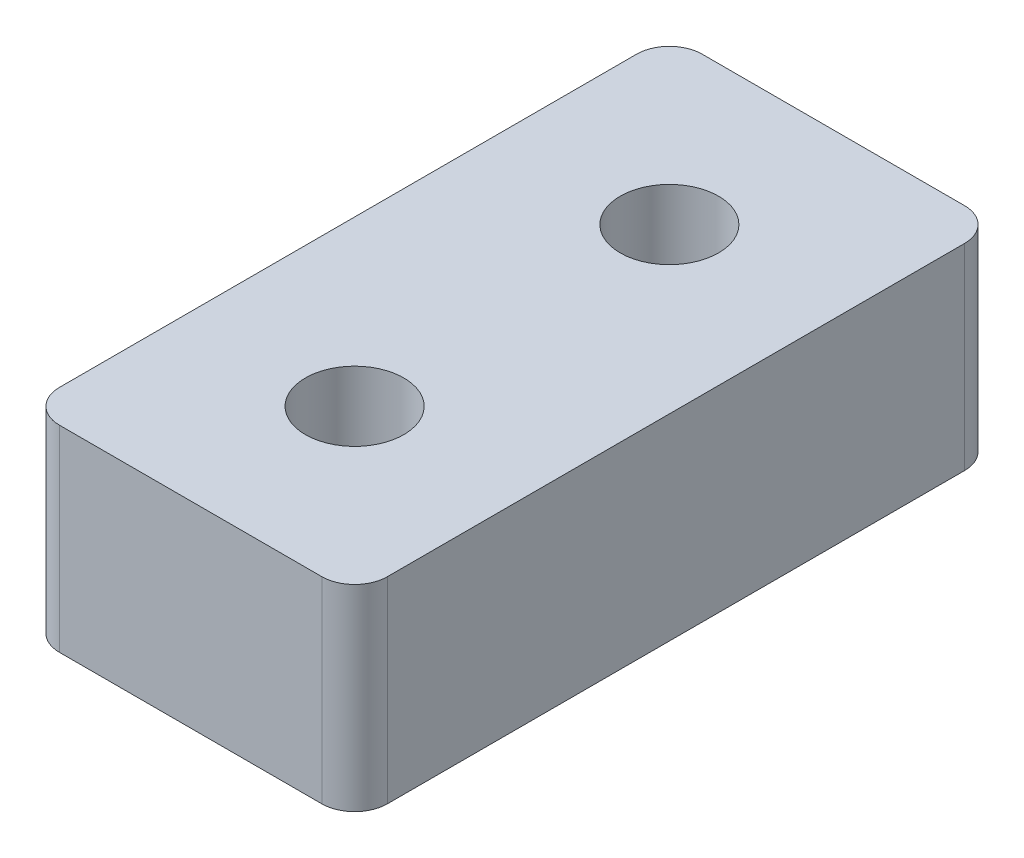
from build123d import *

# Parameters (mm, degrees)
SKETCH1_W           = 10
SKETCH1_H           = 19.6
SKETCH1_R           = 1.5
BOSS_EXTRUDE1_DEPTH = 6
FILLET1_R           = 1


with BuildPart() as part:
    # Sketch1 → Boss-Extrude1 (new body)
    with BuildSketch(Plane(origin=(0, 0, 0), x_dir=(1, 0, 0), z_dir=(0, 1, 0))):
        with Locations((5, 9.8)):
            Rectangle(SKETCH1_W, SKETCH1_H)
        with Locations(Location((5, 14.6, 0), (0, 0, 270))):
            Circle(SKETCH1_R, mode=Mode.SUBTRACT)
        with Locations(Location((5, 5, 0), (0, 0, 270))):
            Circle(SKETCH1_R, mode=Mode.SUBTRACT)
    extrude(amount=BOSS_EXTRUDE1_DEPTH)

    # Fillet1
    fillet1_edges = [part.edges().sort_by_distance(p)[0] for p in [
        (0, 3, -19.6),
        (10, 3, -19.6),
        (10, 3, 0),
        (0, 3, 0),
    ]]
    fillet(fillet1_edges, radius=FILLET1_R)


solid = part.part
